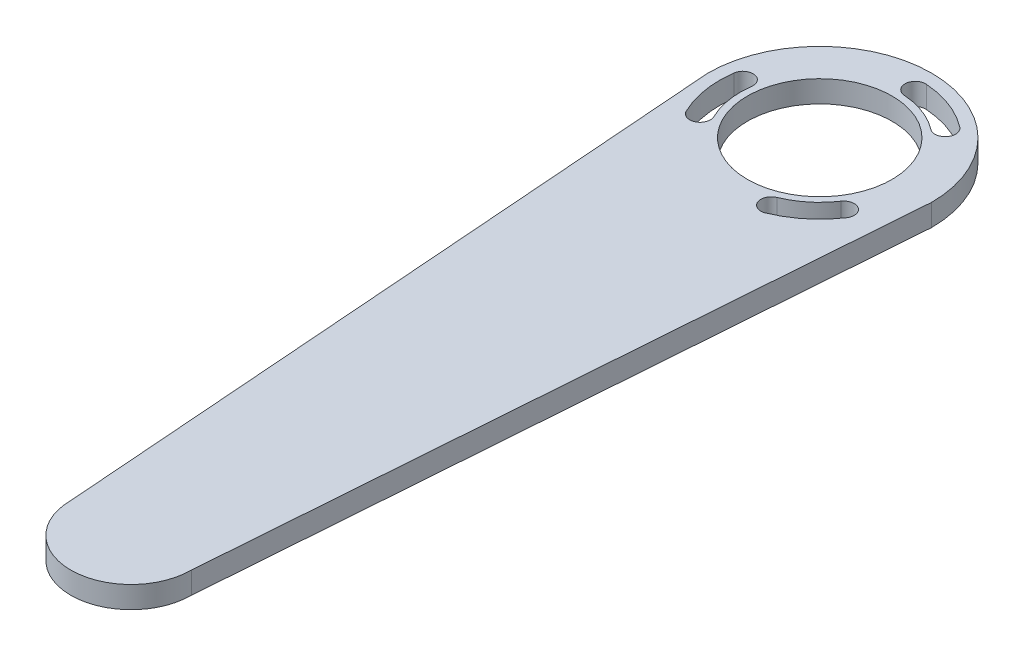
from build123d import *

# Parameters (mm, degrees)
SKETCH1_R           = 17.5
BOSS_EXTRUDE1_DEPTH = 3.175
SKETCH2_R           = 21
CUT_EXTRUDE1_DEPTH  = 221.006414679
CUT_EXTRUDE2_DEPTH  = 221.006414679
CIRPATTERN1_COUNT   = 3
CIRPATTERN1_ANGLE   = 240


with BuildPart() as part:
    # Sketch1 → Boss-Extrude1 (new, symmetric)
    with BuildSketch(Plane(origin=(0, 0, 0), x_dir=(1, 0, 0), z_dir=(0, 1, 0))):
        with BuildLine():
            ThreePointArc((32.5, 0), (0, 32.5), (-32.5, 0))
            Line((-32.5, 0), (-32.136420137, -4.84773151))
            ThreePointArc((-32.136420137, -4.84773151), (0, -32.5), (32.136420137, -4.84773151))
            Line((32.136420137, -4.84773151), (32.5, 0))
        make_face()
        with BuildLine():
            ThreePointArc((32.136420137, -4.84773151), (0, -32.5), (-32.136420137, -4.84773151))
            Line((-32.136420137, -4.84773151), (-17.5, -200))
            ThreePointArc((-17.5, -200), (0, -182.5), (17.5, -200))
            Line((17.5, -200), (32.136420137, -4.84773151))
        make_face()
        with Locations((0, -200)):
            Circle(SKETCH1_R)
    extrude(amount=BOSS_EXTRUDE1_DEPTH, both=True)

    # Sketch2 → Cut-Extrude1 (cut, through all)
    with BuildSketch(Plane(origin=(0, 3.175, 0), x_dir=(1, 0, 0), z_dir=(0, 1, 0))):
        with Locations(Location((0, 0, 0), (0, 0, 270))):
            Circle(SKETCH2_R)
    extrude(amount=-CUT_EXTRUDE1_DEPTH, mode=Mode.SUBTRACT)

    # Sketch4 → Cut-Extrude2 (cut, through all)
    with BuildSketch(Plane.XZ.offset(3.175)):
        with BuildLine():
            ThreePointArc((14.019152987, -18.233577529), (8.163533765, -21.502481635), (1.613875121, -22.943308547))
            ThreePointArc((1.613875121, -22.943308547), (-1.168224891, -26.14641946), (2.034886022, -28.928519473))
            ThreePointArc((2.034886022, -28.928519473), (10.293151268, -27.111824671), (17.676323332, -22.990162972))
            ThreePointArc((17.676323332, -22.990162972), (18.226030881, -18.783285078), (14.019152987, -18.233577529))
        make_face()
    cut_extrude2 = extrude(amount=-CUT_EXTRUDE2_DEPTH, mode=Mode.SUBTRACT)

    # CirPattern1: Cut-Extrude2 ×3 about axis
    cirpattern1_axis = Axis((0, 0, 0), (0, 1, 0))
    for i in range(1, CIRPATTERN1_COUNT):
        add(cut_extrude2.rotate(cirpattern1_axis, i * CIRPATTERN1_ANGLE / (CIRPATTERN1_COUNT - 1)), mode=Mode.SUBTRACT)


solid = part.part
